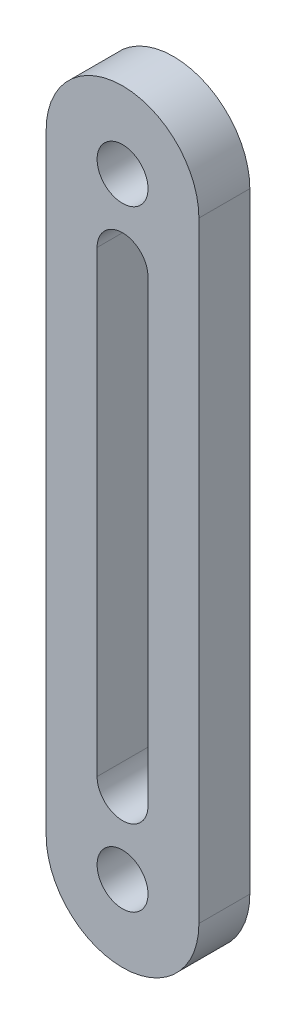
from build123d import *

# Parameters (mm, degrees)
MODEL_R                 = 1.5
SALIENTE_EXTRUIR1_DEPTH = 3


with BuildPart() as part:
    # Model → Saliente-Extruir1 (new body)
    with BuildSketch(Plane.XY):
        with BuildLine():
            Line((213.25077615, 152.428489513), (213.25077615, 188.428489513))
            ThreePointArc((213.25077615, 188.428489513), (208.75077615, 192.928489513), (204.25077615, 188.428489513))
            Line((204.25077615, 188.428489513), (204.25077615, 152.428489513))
            ThreePointArc((204.25077615, 152.428489513), (208.75077615, 147.928489513), (213.25077615, 152.428489513))
        make_face()
        with Locations((208.75077615, 188.428489513)):
            Circle(MODEL_R, mode=Mode.SUBTRACT)
        with Locations((208.75077615, 152.428489513)):
            Circle(MODEL_R, mode=Mode.SUBTRACT)
        with BuildLine():
            Line((207.25077615, 183.928489513), (207.25077615, 156.928489513))
            ThreePointArc((207.25077615, 156.928489513), (208.75077615, 155.428489513), (210.25077615, 156.928489513))
            Line((210.25077615, 156.928489513), (210.25077615, 183.928489513))
            ThreePointArc((210.25077615, 183.928489513), (208.75077615, 185.428489513), (207.25077615, 183.928489513))
        make_face(mode=Mode.SUBTRACT)
    extrude(amount=SALIENTE_EXTRUIR1_DEPTH)


solid = part.part
